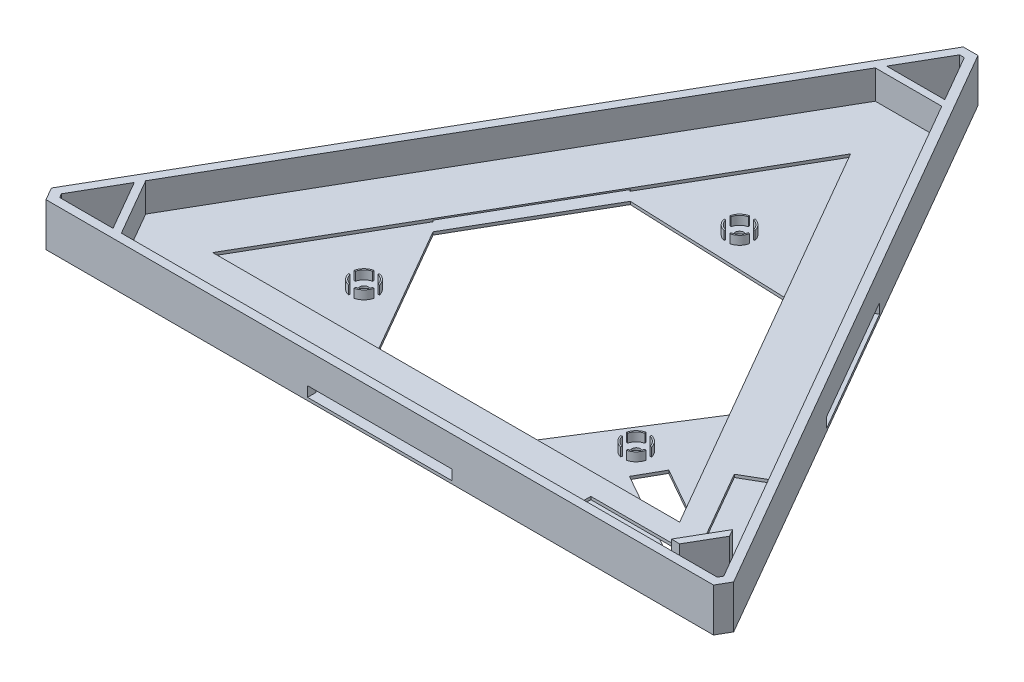
from build123d import *

# Parameters (mm, degrees)
SKETCH1_W                = 34.714871787
SKETCH1_H                = 10.923666426
BOSS_EXTRUDE1_DEPTH      = 1
BOSS_EXTRUDE2_DEPTH      = 11
BOSS_EXTRUDE3_DEPTH      = 5
BOSS_EXTRUDE3_DEPTH_BACK = 3
SKETCH3_W                = 50
SKETCH3_H                = 7
CUT_EXTRUDE3_DEPTH       = 25
SKETCH5_W                = 50
SKETCH5_H                = 7
CUT_EXTRUDE4_DEPTH       = 25
SKETCH6_W                = 50
SKETCH6_H                = 7
CUT_EXTRUDE5_DEPTH       = 25
SKETCH8_R                = 1.5
BOSS_EXTRUDE5_DEPTH      = 1
BOSS_EXTRUDE10_DEPTH     = 3


with BuildPart() as part:
    # Sketch1 → Boss-Extrude1 (new body)
    with BuildSketch(Plane(origin=(0, 0, 0), x_dir=(1, 0, 0), z_dir=(0, 1, 0))):
        Polygon((243.304219775, -116.484791865), (254.809280577, -136.408896137), (442.602090749, -136.409305398), (444.621046679, -132.925433224), (441.749040748, -132.925433224), (449.516726724, -119.471406458), (450.964695298, -121.978953123), (452.699916622, -118.984688018), (358.778179036, 43.666038065), (335.767496284, 43.666038065), align=None)
        with Locations((422.370878913, -129.522754792)):
            Rectangle(SKETCH1_W, SKETCH1_H, mode=Mode.SUBTRACT)
        Polygon((423.190377512, -92.577472767), (432.651287025, -87.114324326), (450.119365975, -117.364996826), (440.658456462, -122.828145267), align=None, mode=Mode.SUBTRACT)
        Polygon((428.113670919, -116.417164681), (266.439108268, -116.428009237), (347.273609729, 23.609230821), align=None, mode=Mode.SUBTRACT)
    extrude(amount=BOSS_EXTRUDE1_DEPTH)

    # Sketch1<9> → Boss-Extrude2 (add)
    # profile 1 of 2: a face of its own
    with BuildSketch(Plane(origin=(0, 0, 0), x_dir=(1, 0, 0), z_dir=(0, 1, 0))):
        Polygon((229.159432548, -134.984249184), (231.716666588, -139.412373829), (462.829865412, -139.412373829), (465.38624875, -134.984588004), (349.829542096, 65.165499075), (344.716133219, 65.165499075), align=None)
        Polygon((251.922647989, -136.409305399), (233.446303401, -136.408896138), (232.62355396, -134.984217357), (241.860901689, -118.984688018), align=None, mode=Mode.SUBTRACT)
        Polygon((442.602090749, -136.409305398), (254.809280577, -136.408896137), (243.304219775, -116.484791865), (335.767496284, 43.666038065), (358.778179036, 43.666038065), (461.938967958, -134.984588006), (461.116393749, -136.409305398), align=None, mode=Mode.SUBTRACT)
        Polygon((348.096628302, 62.164013367), (357.334800991, 46.166038067), (337.210874326, 46.166038067), (346.44844193, 62.165948237), align=None, mode=Mode.SUBTRACT)
    # profile 2 of 2: a face of its own
    with BuildSketch(Plane(origin=(0, 0, 0), x_dir=(1, 0, 0), z_dir=(0, 1, 0))):
        Polygon((441.749040748, -132.925433224), (444.621046679, -132.925433224), (450.964695298, -121.978953123), (449.516726724, -119.471406458), align=None)
    extrude(amount=BOSS_EXTRUDE2_DEPTH)

    # Sketch1<10> → Boss-Extrude3 (add, two sides: drawn at the far end of the back side and taken through both)
    # profile 1 of 2: a face of its own
    with BuildSketch(Plane(origin=(0, 0, 0), x_dir=(1, 0, 0), z_dir=(0, 1, 0)).offset(-BOSS_EXTRUDE3_DEPTH_BACK)):
        Polygon((229.159432548, -134.984249184), (231.716666588, -139.412373829), (462.829865412, -139.412373829), (465.38624875, -134.984588004), (349.829542096, 65.165499075), (344.716133219, 65.165499075), align=None)
        Polygon((251.922647989, -136.409305399), (233.446303401, -136.408896138), (232.62355396, -134.984217357), (241.860901689, -118.984688018), align=None, mode=Mode.SUBTRACT)
        Polygon((442.602090749, -136.409305398), (254.809280577, -136.408896137), (243.304219775, -116.484791865), (335.767496284, 43.666038065), (358.778179036, 43.666038065), (461.938967958, -134.984588006), (461.116393749, -136.409305398), align=None, mode=Mode.SUBTRACT)
        Polygon((348.096628302, 62.164013367), (357.334800991, 46.166038067), (337.210874326, 46.166038067), (346.44844193, 62.165948237), align=None, mode=Mode.SUBTRACT)
    # profile 2 of 2: a face of its own
    with BuildSketch(Plane(origin=(0, 0, 0), x_dir=(1, 0, 0), z_dir=(0, 1, 0)).offset(-BOSS_EXTRUDE3_DEPTH_BACK)):
        Polygon((441.749040748, -132.925433224), (444.621046679, -132.925433224), (450.964695298, -121.978953123), (449.516726724, -119.471406458), align=None)
    extrude(amount=BOSS_EXTRUDE3_DEPTH + BOSS_EXTRUDE3_DEPTH_BACK)

    # Sketch3 → Cut-Extrude3 (cut)
    with BuildSketch(Plane(origin=(290.589645397, 0, -167.772009994), x_dir=(-0.49999999999998745, 0, -0.8660254037844459), z_dir=(0.8660254037844459, 0, -0.49999999999998745))):
        with Locations((-236.592990632, -3)):
            Rectangle(SKETCH3_W, SKETCH3_H)
    extrude(amount=-CUT_EXTRUDE3_DEPTH, mode=Mode.SUBTRACT)

    # Sketch5 → Cut-Extrude4 (cut)
    with BuildSketch(Plane.XY.offset(139.412373829)):
        with Locations((347.273266, -3)):
            Rectangle(SKETCH5_W, SKETCH5_H)
    extrude(amount=-CUT_EXTRUDE4_DEPTH, mode=Mode.SUBTRACT)

    # Sketch6 → Cut-Extrude5 (cut)
    with BuildSketch(Plane(origin=(230.319375798, 0, 132.975171837), x_dir=(-0.5000006154012504, 0, 0.8660250484820695), z_dir=(-0.8660250484820695, 0, -0.5000006154012504))):
        with Locations((-113.236674799, -3)):
            Rectangle(SKETCH6_W, SKETCH6_H)
    extrude(amount=-CUT_EXTRUDE5_DEPTH, mode=Mode.SUBTRACT)

    # Sketch8 → Boss-Extrude5 (add)
    with BuildSketch(Plane.XZ.offset(3)):
        Polygon((349.829542096, -65.165499075), (465.38624875, 134.984588004), (462.829865412, 139.412373829), (231.716666588, 139.412373829), (229.159432548, 134.984249184), (344.716133219, -65.165499075), align=None)
        with Locations((395.323540807, 98.692824234)):
            Circle(SKETCH8_R, mode=Mode.SUBTRACT)
        with Locations((348.301285091, 15.863526629)):
            Circle(SKETCH8_R, mode=Mode.SUBTRACT)
        with Locations((299.654911442, 97.24168178)):
            Circle(SKETCH8_R, mode=Mode.SUBTRACT)
        Polygon((450.14703547, 123.280701064), (452.699916622, 118.984688018), (461.938967958, 134.984588006), (461.116393749, 136.409305398), (442.602090749, 136.409305398), (445.226665069, 131.986443715), (401.697951811, 107.384591709), (406.618322213, 98.678849058), align=None, mode=Mode.SUBTRACT)
        Polygon((322.273266, 116.42426408), (294.358218631, 68.061097964), (319.354499367, 24.757680453), (376.473657316, 26.969372806), (401.47267951, 70.271207531), (372.273266, 116.420910257), align=None, mode=Mode.SUBTRACT)
        Polygon((233.446303401, 136.408896138), (251.922647989, 136.409305399), (241.860901689, 118.984688018), (232.62355396, 134.984217357), align=None, mode=Mode.SUBTRACT)
        Polygon((337.210874326, -46.166038067), (357.334800991, -46.166038067), (348.096628302, -62.164013367), (346.44844193, -62.165948237), align=None, mode=Mode.SUBTRACT)
    extrude(amount=BOSS_EXTRUDE5_DEPTH)

    # Sketch12 → Boss-Extrude10 (add)
    with BuildSketch(Plane(origin=(0, -3, 0), x_dir=(1, 0, 0), z_dir=(0, 1, 0))):
        with BuildLine():
            ThreePointArc((352.690173981, -14.869718639), (351.483265607, -12.681546114), (349.295093082, -11.47463774))
            Line((349.295093081, -11.47463774), (349.184669971, -11.962292061))
            ThreePointArc((349.184669972, -11.962292061), (351.129712216, -13.035099504), (352.20251966, -14.980141749))
            Line((352.202519659, -14.980141749), (352.69017398, -14.869718639))
        make_face()
        with BuildLine():
            Line((347.417900211, -11.962292061), (347.307477101, -11.47463774))
            ThreePointArc((347.307477101, -11.47463774), (345.119304576, -12.681546114), (343.912396202, -14.869718639))
            Line((343.912396203, -14.869718639), (344.400050524, -14.980141749))
            ThreePointArc((344.400050523, -14.980141749), (345.472857967, -13.035099504), (347.417900211, -11.962292061))
        make_face()
        with BuildLine():
            ThreePointArc((349.295093082, -20.252415518), (351.483265607, -19.045507145), (352.690173981, -16.857334619))
            Line((352.69017398, -16.857334619), (352.202519659, -16.746911509))
            ThreePointArc((352.20251966, -16.746911509), (351.129712216, -18.691953754), (349.184669972, -19.764761197))
            Line((349.184669971, -19.764761197), (349.295093081, -20.252415518))
        make_face()
        with BuildLine():
            Line((344.400050524, -16.746911509), (343.912396203, -16.857334619))
            ThreePointArc((343.912396202, -16.857334619), (345.119304576, -19.045507145), (347.307477101, -20.252415518))
            Line((347.307477101, -20.252415518), (347.417900211, -19.764761197))
            ThreePointArc((347.417900211, -19.764761197), (345.472857967, -18.691953754), (344.400050523, -16.746911509))
        make_face()
        with BuildLine():
            Line((394.440155927, -94.791589666), (394.329732817, -94.303935345))
            ThreePointArc((394.329732817, -94.303935345), (392.141560292, -95.510843718), (390.934651918, -97.699016244))
            Line((390.934651918, -97.699016244), (391.4247896, -97.798542945))
            ThreePointArc((391.4247896, -97.798542945), (392.499067689, -95.860448622), (394.440155927, -94.791589666))
        make_face()
        with BuildLine():
            ThreePointArc((399.712429696, -97.699016244), (398.505521323, -95.510843718), (396.317348797, -94.303935345))
            Line((396.317348797, -94.303935345), (396.206925687, -94.791589666))
            ThreePointArc((396.206925687, -94.791589666), (398.151967932, -95.864397109), (399.224775375, -97.809439354))
            Line((399.224775375, -97.809439354), (399.712429696, -97.699016244))
        make_face()
        with BuildLine():
            Line((391.422306239, -99.576209114), (390.934651918, -99.686632224))
            ThreePointArc((390.934651918, -99.686632224), (392.141560292, -101.874804749), (394.329732817, -103.081713123))
            Line((394.329732817, -103.081713122), (394.440155927, -102.594058801))
            ThreePointArc((394.440155927, -102.594058802), (392.495113682, -101.521251358), (391.422306239, -99.576209114))
        make_face()
        with BuildLine():
            ThreePointArc((396.317348797, -103.081713123), (398.505521323, -101.874804749), (399.712429696, -99.686632224))
            Line((399.712429696, -99.686632224), (399.224775375, -99.576209114))
            ThreePointArc((399.224775375, -99.576209114), (398.151967932, -101.521251358), (396.206925687, -102.594058802))
            Line((396.206925687, -102.594058801), (396.317348797, -103.081713122))
        make_face()
        with BuildLine():
            ThreePointArc((298.661103452, -92.852792892), (296.472930927, -94.059701265), (295.266022553, -96.24787379))
            Line((295.266022553, -96.24787379), (295.753676874, -96.3582969))
            ThreePointArc((295.753676874, -96.3582969), (296.826484317, -94.413254656), (298.771526562, -93.340447213))
            Line((298.771526562, -93.340447212), (298.661103452, -92.852792891))
        make_face()
        with BuildLine():
            Line((295.753676874, -98.12506666), (295.266022553, -98.23548977))
            ThreePointArc((295.266022553, -98.23548977), (296.472930927, -100.423662295), (298.661103452, -101.630570669))
            Line((298.661103452, -101.630570669), (298.771526562, -101.142916348))
            ThreePointArc((298.771526562, -101.142916348), (296.826484317, -100.070108905), (295.753676874, -98.12506666))
        make_face()
        with BuildLine():
            ThreePointArc((304.04380033, -96.24787379), (302.836891957, -94.059701265), (300.648719432, -92.852792892))
            Line((300.648719432, -92.852792891), (300.538296322, -93.340447212))
            ThreePointArc((300.538296322, -93.340447213), (302.483338566, -94.413254656), (303.55614601, -96.3582969))
            Line((303.55614601, -96.3582969), (304.043800331, -96.24787379))
        make_face()
        with BuildLine():
            Line((300.538296322, -101.142916348), (300.648719432, -101.630570669))
            ThreePointArc((300.648719432, -101.630570669), (302.836891957, -100.423662295), (304.04380033, -98.23548977))
            Line((304.043800331, -98.23548977), (303.55614601, -98.12506666))
            ThreePointArc((303.55614601, -98.12506666), (302.483338566, -100.070108905), (300.538296322, -101.142916348))
        make_face()
    extrude(amount=BOSS_EXTRUDE10_DEPTH)


solid = part.part
